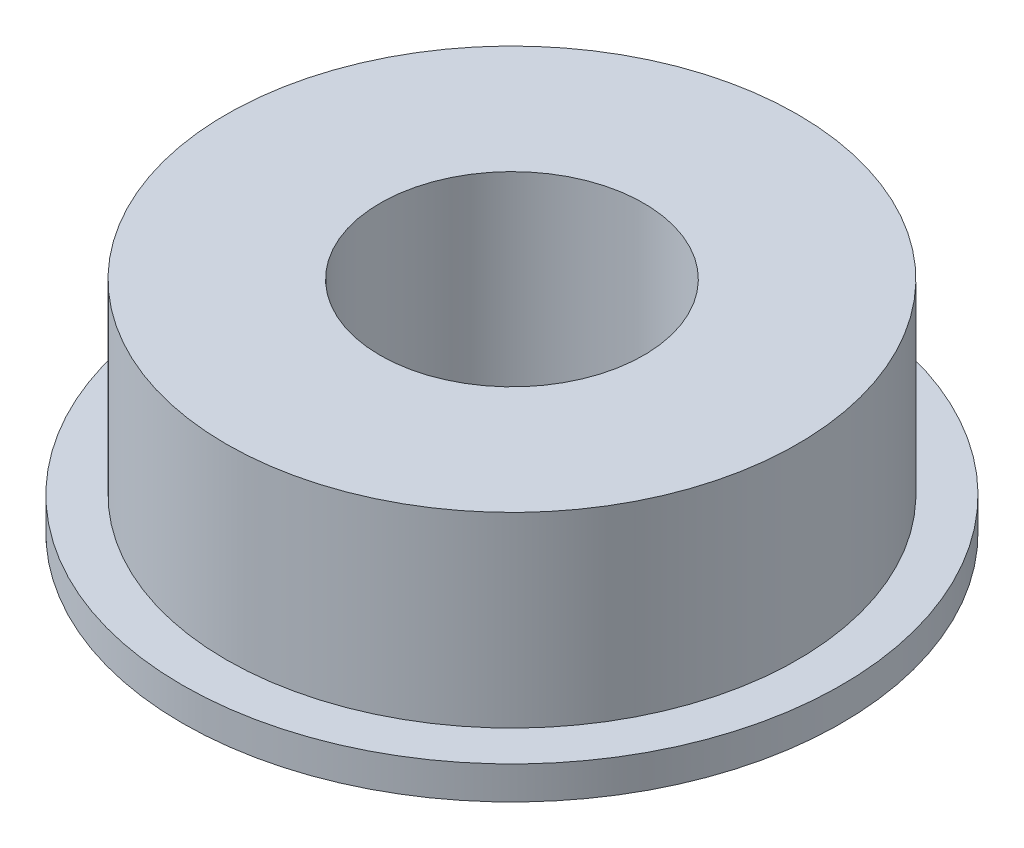
from build123d import *


with BuildPart() as part:
    # Sketch1 → Revolve1 (revolve)
    with BuildSketch(Plane.XY, mode=Mode.PRIVATE) as revolve1_sk:
        Polygon((3, 0), (7.5, 0), (7.5, 0.75), (6.5, 0.75), (6.5, 5), (3, 5), align=None)
    revolve(revolve1_sk.sketch.rotate(Axis((0, 133.35, 0), (0, -1, 0)), 90), axis=Axis((0, 133.35, 0), (0, -1, 0)))


solid = part.part
